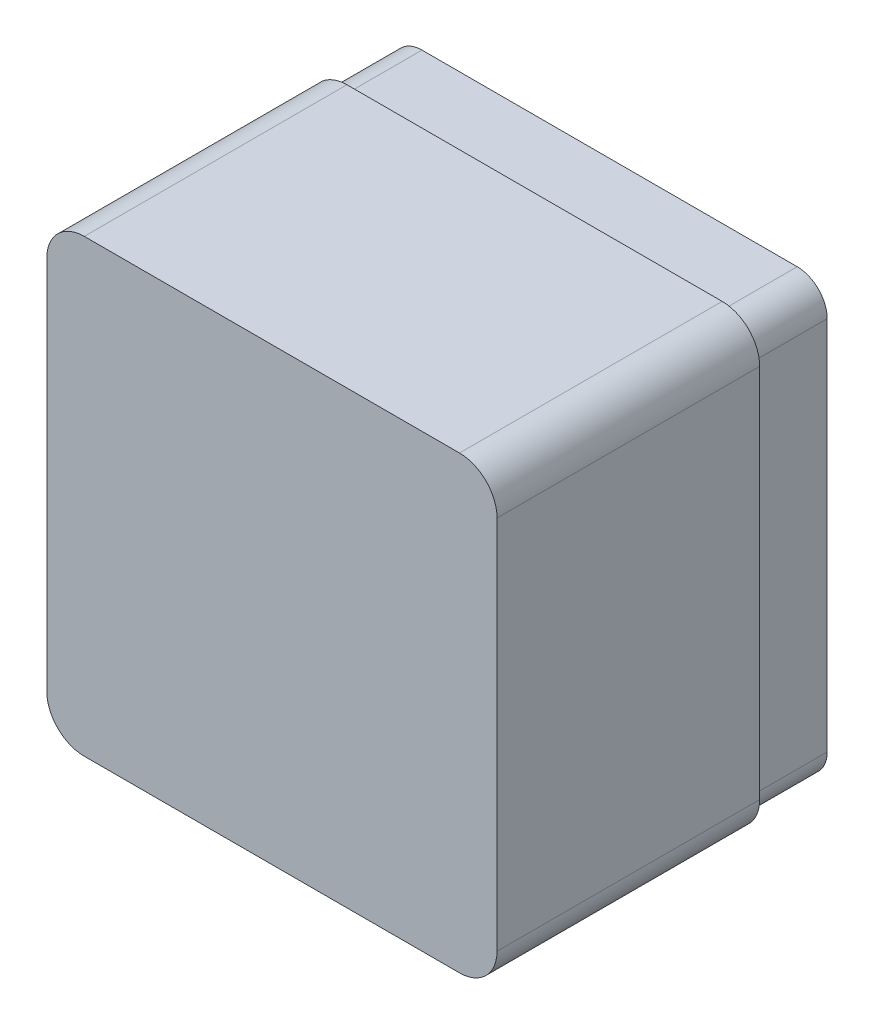
from build123d import *

# Parameters (mm, degrees)
SKETCH1_W           = 120
SKETCH1_H           = 120
BOSS_EXTRUDE1_DEPTH = 90
FILLET1_R           = 10
SHELL1_T            = -4
CUT_EXTRUDE1_START  = -20
CUT_EXTRUDE1_DEPTH  = 20


with BuildPart() as part:
    # Sketch1 → Boss-Extrude1 (new body)
    with BuildSketch(Plane.XY):
        with Locations((60, 60)):
            Rectangle(SKETCH1_W, SKETCH1_H)
    extrude(amount=BOSS_EXTRUDE1_DEPTH)

    # Fillet1
    fillet1_edges = [part.edges().sort_by_distance(p)[0] for p in [
        (0, 120, 45),
        (120, 120, 45),
        (120, 0, 45),
        (0, 0, 45),
    ]]
    fillet(fillet1_edges, radius=FILLET1_R)

    # Shell1
    shell1_openings = [part.faces().sort_by_distance(p)[0] for p in [
        (60, 60, 0),
    ]]
    offset(amount=SHELL1_T, openings=shell1_openings, kind=Kind.INTERSECTION)

    # Sketch2 → Cut-Extrude1 (cut)
    with BuildSketch(Plane(origin=(0, 0, 0), x_dir=(-1, 0, 0), z_dir=(0, 0, -1)).offset(CUT_EXTRUDE1_START)):
        with BuildLine():
            Line((-110, 0), (-10, 0))
            ThreePointArc((-10, 0), (-2.928932188, 2.928932188), (0, 10))
            Line((0, 10), (0, 110))
            ThreePointArc((0, 110), (-2.928932188, 117.071067812), (-10, 120))
            Line((-10, 120), (-110, 120))
            ThreePointArc((-110, 120), (-117.071067812, 117.071067812), (-120, 110))
            Line((-120, 110), (-120, 10))
            ThreePointArc((-120, 10), (-117.071067812, 2.928932188), (-110, 0))
        make_face()
        with BuildLine():
            Line((-110, 2), (-10, 2))
            ThreePointArc((-10, 2), (-4.343145751, 4.343145751), (-2, 10))
            Line((-2, 10), (-2, 110))
            ThreePointArc((-2, 110), (-4.343145751, 115.656854249), (-10, 118))
            Line((-10, 118), (-110, 118))
            ThreePointArc((-110, 118), (-115.656854249, 115.656854249), (-118, 110))
            Line((-118, 110), (-118, 10))
            ThreePointArc((-118, 10), (-115.656854249, 4.343145751), (-110, 2))
        make_face(mode=Mode.SUBTRACT)
    extrude(amount=CUT_EXTRUDE1_DEPTH, mode=Mode.SUBTRACT)


solid = part.part
